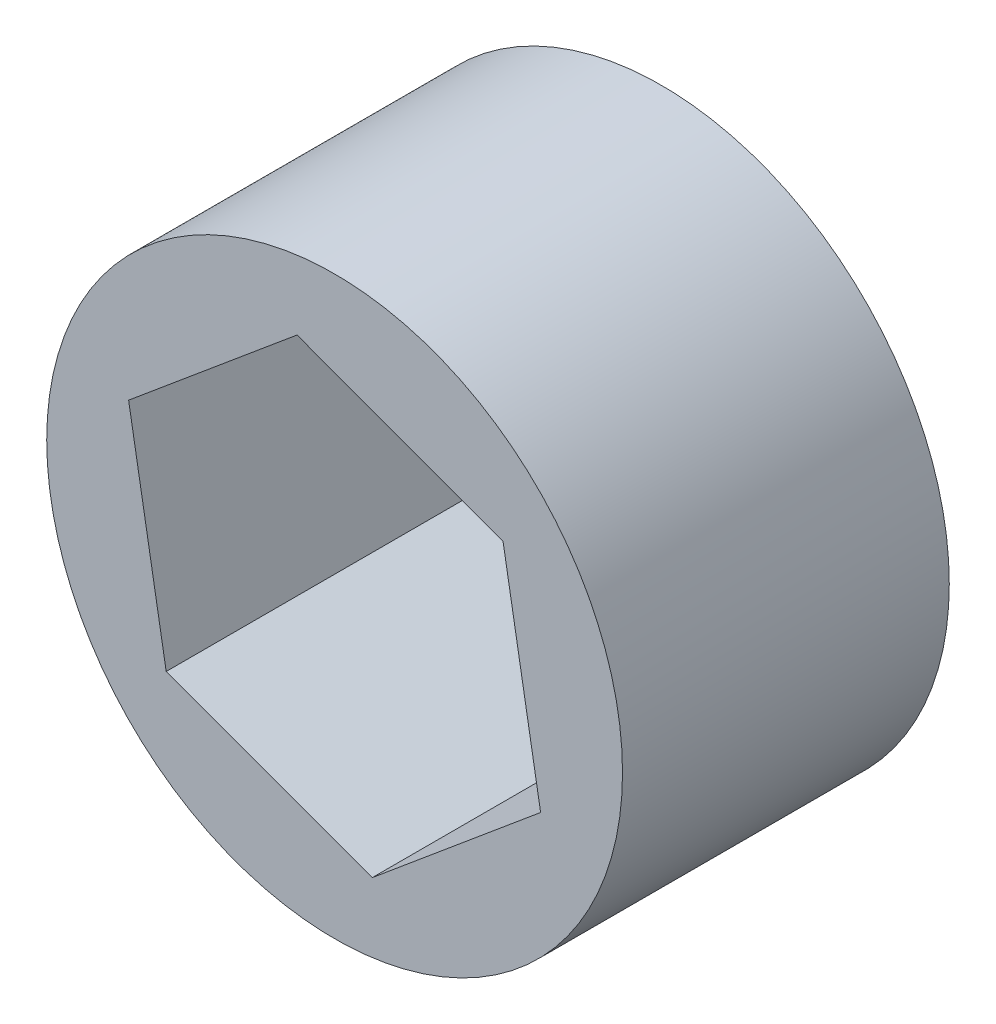
from build123d import *

# Parameters (mm, degrees)
SKETCH1_R           = 9.999999939
BOSS_EXTRUDE1_DEPTH = 11.35


with BuildPart() as part:
    # Sketch1 → Boss-Extrude1 (new body)
    with BuildSketch(Plane.XY):
        Circle(SKETCH1_R)
        Polygon((-7.155198517, 2.62357279), (-5.849679943, -4.88479729), (1.305518574, -7.50837008), (7.155198517, -2.62357279), (5.849679943, 4.88479729), (-1.305518574, 7.50837008), align=None, mode=Mode.SUBTRACT)
    extrude(amount=BOSS_EXTRUDE1_DEPTH)


solid = part.part
